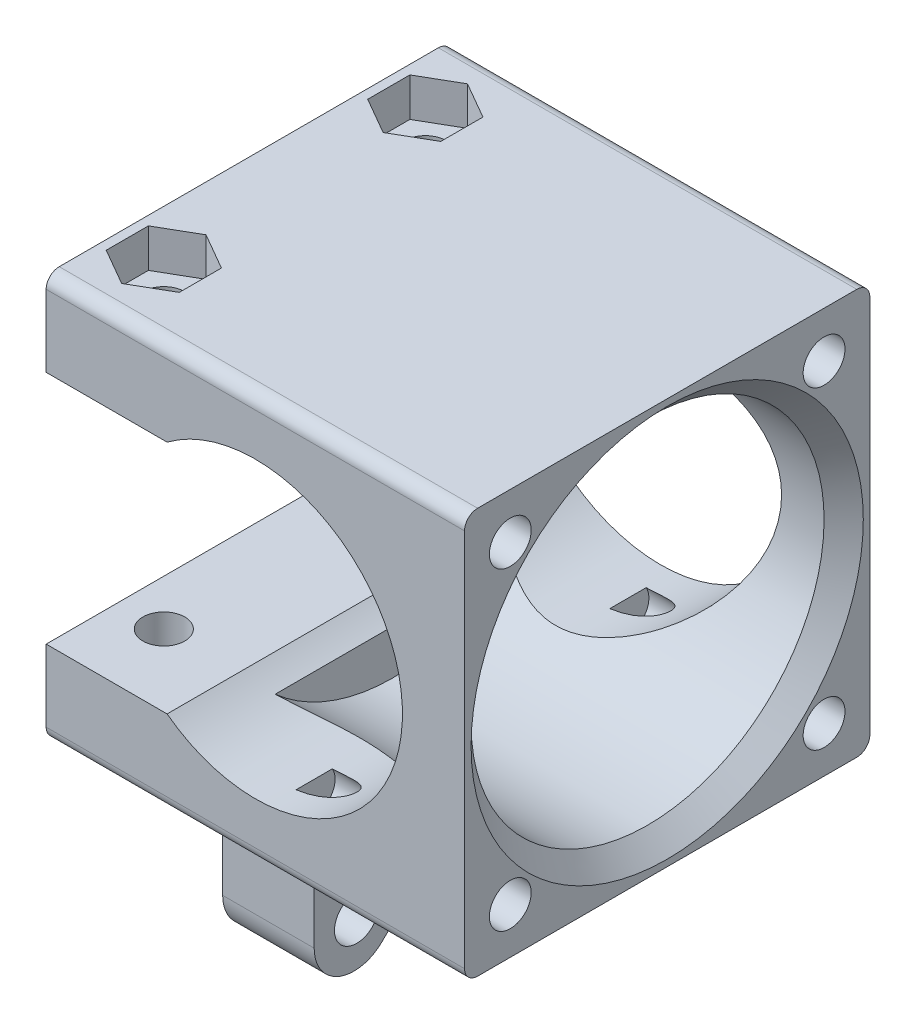
from build123d import *

# Parameters (mm, degrees)
SKETCH1_W           = 31
SKETCH1_H           = 31
BOSS_EXTRUDE1_DEPTH = 16
FILLET1_R           = 1
SKETCH2_R           = 13.5
CUT_EXTRUDE1_DEPTH  = 21
SKETCH3_R           = 1.6
CUT_EXTRUDE2_DEPTH  = 15
CUT_EXTRUDE3_DEPTH  = 39.173943993
SKETCH5_R           = 1.6
CUT_EXTRUDE4_DEPTH  = 47.669047659
CUT_EXTRUDE5_DEPTH  = 2.95
SKETCH7_R           = 2.85
CUT_EXTRUDE6_DEPTH  = 2.95
BOSS_EXTRUDE2_START = -12.5
BOSS_EXTRUDE2_DEPTH = 7
SKETCH9_R           = 1.70000037
CUT_EXTRUDE7_DEPTH  = 44.213437626
CHAMFER1_SIZE       = 1.5


with BuildPart() as part:
    # Sketch1 → Boss-Extrude1 (new, symmetric)
    with BuildSketch(Plane(origin=(0, 0, 0), x_dir=(0, 0, -1), z_dir=(1, 0, 0))):
        with Locations((-15.5, 0)):
            Rectangle(SKETCH1_W, SKETCH1_H)
    extrude(amount=BOSS_EXTRUDE1_DEPTH, both=True)

    # Fillet1
    fillet1_edges = [part.edges().sort_by_distance(p)[0] for p in [
        (0, -15.5, 0),
        (0, -15.5, 31),
        (0, 15.5, 31),
        (0, 15.5, 0),
    ]]
    fillet(fillet1_edges, radius=FILLET1_R)

    # Sketch2 → Cut-Extrude1 (cut)
    with BuildSketch(Plane(origin=(16, 0, 0), x_dir=(0, 0, -1), z_dir=(1, 0, 0))):
        with Locations((-15.5, 0)):
            Circle(SKETCH2_R)
    extrude(amount=-CUT_EXTRUDE1_DEPTH, mode=Mode.SUBTRACT)

    # Sketch3 → Cut-Extrude2 (cut)
    with BuildSketch(Plane(origin=(16, 0, 0), x_dir=(0, 0, -1), z_dir=(1, 0, 0))):
        with Locations((-27.5, 12)):
            Circle(SKETCH3_R)
        with Locations((-3.5, 12)):
            Circle(SKETCH3_R)
        with Locations((-3.5, -12)):
            Circle(SKETCH3_R)
        with Locations((-27.5, -12)):
            Circle(SKETCH3_R)
    extrude(amount=-CUT_EXTRUDE2_DEPTH, mode=Mode.SUBTRACT)

    # Sketch4 → Cut-Extrude3 (cut, through all)
    with BuildSketch(Plane.XY.offset(31)):
        with BuildLine():
            Line((-6.75, 9), (-16, 9))
            Line((-16, 9), (-16, -9))
            Line((-16, -9), (-6.75, -9))
            ThreePointArc((-6.75, -9), (11.25, 0), (-6.75, 9))
        make_face()
    extrude(amount=-CUT_EXTRUDE3_DEPTH, mode=Mode.SUBTRACT)

    # Sketch5 → Cut-Extrude4 (cut, through all)
    with BuildSketch(Plane(origin=(0, 15.5, 0), x_dir=(1, 0, 0), z_dir=(0, 1, 0))):
        with Locations(Location((-12.5, -5.5, 0), (0, 0, 270))):
            Circle(SKETCH5_R)
        with Locations(Location((-12.5, -25.5, 0), (0, 0, 270))):
            Circle(SKETCH5_R)
    extrude(amount=-CUT_EXTRUDE4_DEPTH, mode=Mode.SUBTRACT)

    # Sketch6 → Cut-Extrude5 (cut)
    with BuildSketch(Plane(origin=(0, 15.5, 0), x_dir=(1, 0, 0), z_dir=(0, 1, 0))):
        Polygon((-12.5, -8.725425014), (-9.7067, -7.112712507), (-9.7067, -3.887287493), (-12.5, -2.274574986), (-15.2933, -3.887287493), (-15.2933, -7.112712507), align=None)
        Polygon((-9.7067, -27.112712507), (-9.7067, -23.887287493), (-12.5, -22.274574986), (-15.2933, -23.887287493), (-15.2933, -27.112712507), (-12.5, -28.725425014), align=None)
    extrude(amount=-CUT_EXTRUDE5_DEPTH, mode=Mode.SUBTRACT)

    # Sketch7 → Cut-Extrude6 (cut)
    with BuildSketch(Plane.XZ.offset(15.5)):
        with Locations(Location((-12.5, 25.5, 0), (0, 0, 270))):
            Circle(SKETCH7_R)
        with Locations(Location((-12.5, 5.5, 0), (0, 0, 270))):
            Circle(SKETCH7_R)
    extrude(amount=-CUT_EXTRUDE6_DEPTH, mode=Mode.SUBTRACT)

    # Sketch8 → Boss-Extrude2 (add)
    with BuildSketch(Plane(origin=(16, 0, 0), x_dir=(0, 0, -1), z_dir=(1, 0, 0)).offset(BOSS_EXTRUDE2_START)):
        with BuildLine():
            Line((-30, -15.5), (-30, -19.893951988))
            ThreePointArc((-30, -19.893951988), (-28.14780731, -22.694961806), (-24.845223874, -22.087329999))
            Line((-24.845223874, -22.087329999), (-18, -15.5))
            Line((-18, -15.5), (-30, -15.5))
        make_face()
    extrude(amount=-BOSS_EXTRUDE2_DEPTH)

    # Sketch9 → Cut-Extrude7 (cut, through all)
    with BuildSketch(Plane(origin=(3.5, 0, 0), x_dir=(0, 0, -1), z_dir=(1, 0, 0))):
        with Locations((-26.749999873, -19.500000979)):
            Circle(SKETCH9_R)
    extrude(amount=-CUT_EXTRUDE7_DEPTH, mode=Mode.SUBTRACT)

    # Chamfer1
    chamfer1_edges = [part.edges().sort_by_distance(p)[0] for p in [
        (16, 0, 29),
    ]]
    chamfer(chamfer1_edges, length=CHAMFER1_SIZE)


solid = part.part
